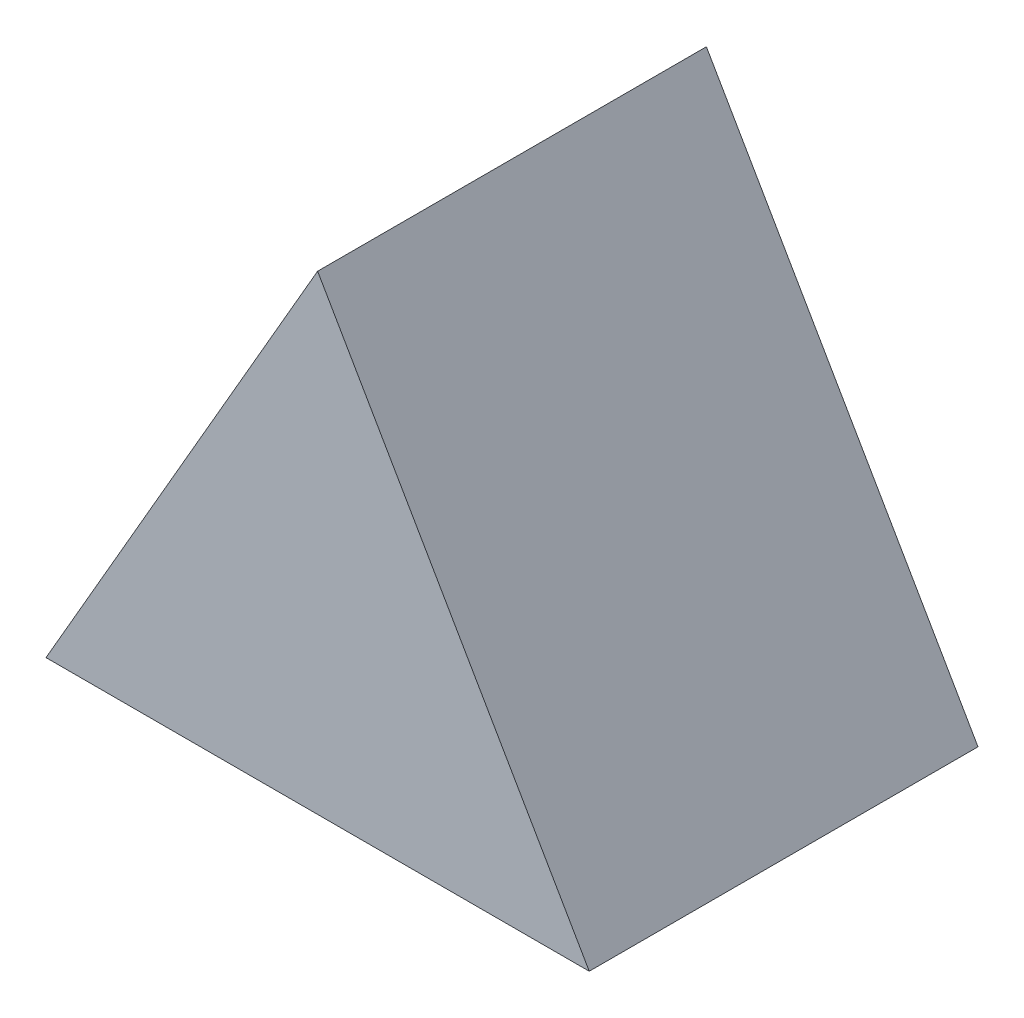
from build123d import *

# Parameters (mm, degrees)
EXTRUDE_1_DEPTH = 3.8


with BuildPart() as part:
    # Эскиз1 → Бобышка-Вытянуть1 (new body)
    with BuildSketch(Plane.XY):
        Polygon((-2.655, -1.515952629), (2.655, -1.515952629), (0, 3.082642266), align=None)
    extrude(amount=EXTRUDE_1_DEPTH)


solid = part.part
